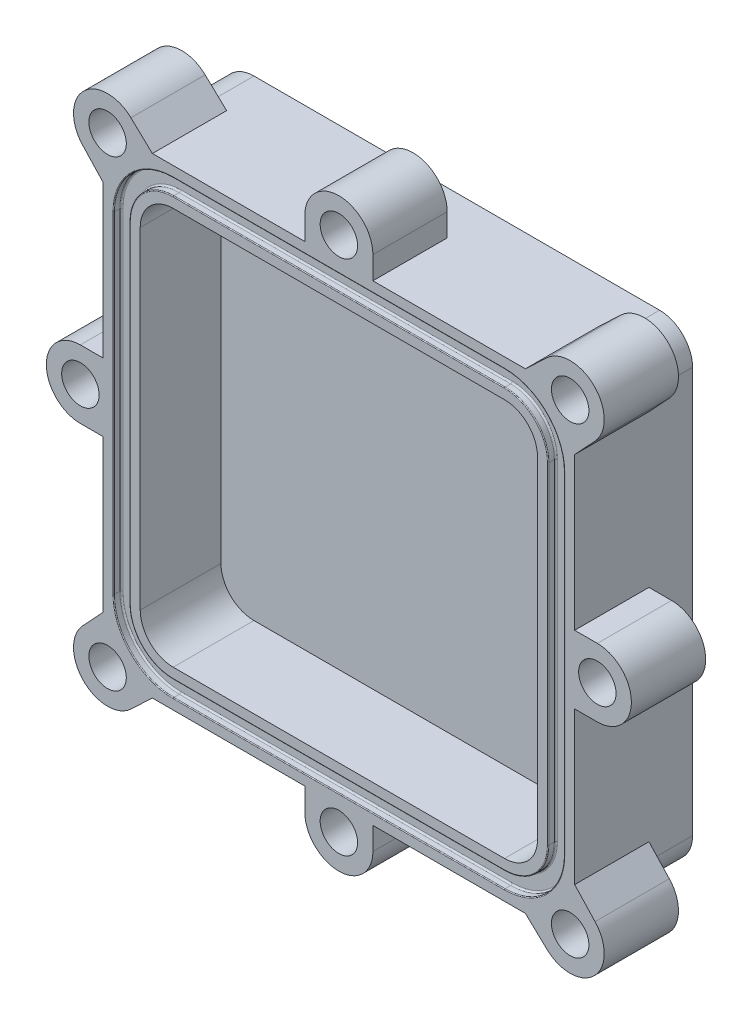
from build123d import *

# Parameters (mm, degrees)
SKETCH1_W               = 76.2
SKETCH1_H               = 76.2
BOSS_EXTRUDE1_DEPTH     = 19.05
SHELL4_T                = -6
FILLET3_R               = 5.334
FILLET4_R               = 5.334
CUT_EXTRUDE1_DEPTH      = 1.2446
FILLET5_R               = 0.254
FILLET6_R               = 0.127
BOSS_EXTRUDE2_DEPTH     = 12
SKETCH6_R               = 3.025
CUT_EXTRUDE2_DEPTH      = 9
MIRROR2_COPY_1_DEPTH    = 12
MIRROR2_COPY_2_SKETCH_R = 3.025
MIRROR2_COPY_2_DEPTH    = 9
SKETCH7_R               = 3.025
BOSS_EXTRUDE3_DEPTH     = 12
SKETCH8_R               = 3.025
CUT_EXTRUDE4_DEPTH      = 9
CIRPATTERN1_COUNT       = 4


with BuildPart() as part:
    # Sketch1 → Boss-Extrude1 (new body)
    with BuildSketch(Plane.XY):
        Rectangle(SKETCH1_W, SKETCH1_H)
    extrude(amount=BOSS_EXTRUDE1_DEPTH)

    # Shell4
    shell4_openings = [part.faces().sort_by_distance(p)[0] for p in [
        (0, 0, 19.05),
    ]]
    offset(amount=SHELL4_T, openings=shell4_openings, kind=Kind.INTERSECTION)

    # Fillet3
    fillet3_edges = [part.edges().sort_by_distance(p)[0] for p in [
        (32.1, -32.1, 12.525),
        (32.1, 32.1, 12.525),
        (-32.1, 32.1, 12.525),
        (-32.1, -32.1, 12.525),
    ]]
    fillet(fillet3_edges, radius=FILLET3_R)

    # Fillet4
    fillet4_edges = [part.edges().sort_by_distance(p)[0] for p in [
        (38.1, -38.1, 9.525),
        (-38.1, -38.1, 9.525),
        (-38.1, 38.1, 9.525),
        (38.1, 38.1, 9.525),
    ]]
    fillet(fillet4_edges, radius=FILLET4_R)

    # Sketch3 → Cut-Extrude1 (cut)
    with BuildSketch(Plane.XY.offset(19.05)):
        with BuildLine():
            Line((36.3827, -26.766), (36.3827, 26.766))
            ThreePointArc((36.3827, 26.766), (33.566033783, 33.566033783), (26.766, 36.3827))
            Line((26.766, 36.3827), (-26.766, 36.3827))
            ThreePointArc((-26.766, 36.3827), (-33.566033783, 33.566033783), (-36.3827, 26.766))
            Line((-36.3827, 26.766), (-36.3827, -26.766))
            ThreePointArc((-36.3827, -26.766), (-33.566033783, -33.566033783), (-26.766, -36.3827))
            Line((-26.766, -36.3827), (26.766, -36.3827))
            ThreePointArc((26.766, -36.3827), (33.566033783, -33.566033783), (36.3827, -26.766))
        make_face()
        with BuildLine():
            Line((-33.8173, 26.766), (-33.8173, -26.766))
            ThreePointArc((-33.8173, -26.766), (-31.752022046, -31.752022046), (-26.766, -33.8173))
            Line((-26.766, -33.8173), (26.766, -33.8173))
            ThreePointArc((26.766, -33.8173), (31.752022046, -31.752022046), (33.8173, -26.766))
            Line((33.8173, -26.766), (33.8173, 26.766))
            ThreePointArc((33.8173, 26.766), (31.752022046, 31.752022046), (26.766, 33.8173))
            Line((26.766, 33.8173), (-26.766, 33.8173))
            ThreePointArc((-26.766, 33.8173), (-31.752022046, 31.752022046), (-33.8173, 26.766))
        make_face(mode=Mode.SUBTRACT)
    extrude(amount=-CUT_EXTRUDE1_DEPTH, mode=Mode.SUBTRACT)

    # Fillet5
    fillet5_edges = [part.edges().sort_by_distance(p)[0] for p in [
        (33.566033783, -33.566033783, 17.8054),
        (0, -36.3827, 17.8054),
        (-33.566033783, -33.566033783, 17.8054),
        (-36.3827, 0, 17.8054),
        (-33.566033783, 33.566033783, 17.8054),
        (0, 36.3827, 17.8054),
        (33.566033783, 33.566033783, 17.8054),
        (36.3827, 0, 17.8054),
        (0, 33.8173, 17.8054),
        (-31.752022046, 31.752022046, 17.8054),
        (-33.8173, 0, 17.8054),
        (-31.752022046, -31.752022046, 17.8054),
        (0, -33.8173, 17.8054),
        (31.752022046, -31.752022046, 17.8054),
        (33.8173, 0, 17.8054),
        (31.752022046, 31.752022046, 17.8054),
    ]]
    fillet(fillet5_edges, radius=FILLET5_R)

    # Fillet6
    fillet6_edges = [part.edges().sort_by_distance(p)[0] for p in [
        (33.566033783, -33.566033783, 19.05),
        (36.3827, 0, 19.05),
        (33.566033783, 33.566033783, 19.05),
        (0, 36.3827, 19.05),
        (-33.566033783, 33.566033783, 19.05),
        (-36.3827, 0, 19.05),
        (-33.566033783, -33.566033783, 19.05),
        (0, -36.3827, 19.05),
        (-31.752022046, 31.752022046, 19.05),
        (0, 33.8173, 19.05),
        (31.752022046, 31.752022046, 19.05),
        (33.8173, 0, 19.05),
        (31.752022046, -31.752022046, 19.05),
        (0, -33.8173, 19.05),
        (-31.752022046, -31.752022046, 19.05),
        (-33.8173, 0, 19.05),
    ]]
    fillet(fillet6_edges, radius=FILLET6_R)

    # Sketch5 → Boss-Extrude2 (add)
    with BuildSketch(Plane.XY.offset(19.05)):
        with BuildLine():
            Line((31.920914663, -38.1), (30.131751686, -38.1))
            Line((30.131751686, -38.1), (33.596647392, -41.371622715))
            ThreePointArc((33.596647392, -41.371622715), (32.477377499, -39.879946896), (31.920914663, -38.1))
        make_face()
        with BuildLine():
            ThreePointArc((38.1, -31.920914663), (39.894470489, -32.484843755), (41.393974839, -33.620461233))
            Line((41.393974839, -33.620461233), (38.1, -30.090129163))
            Line((38.1, -30.090129163), (38.1, -31.920914663))
        make_face()
        with BuildLine():
            ThreePointArc((31.920914663, -38.1), (32.477377499, -39.879946896), (33.596647392, -41.371622715))
            ThreePointArc((33.596647392, -41.371622715), (39.550014312, -42.423232807), (42.872601718, -37.372601718))
            ThreePointArc((42.872601718, -37.372601718), (42.489610227, -35.356113703), (41.393974839, -33.620461233))
            ThreePointArc((41.393974839, -33.620461233), (39.894470489, -32.484843755), (38.1, -31.920914663))
            Line((38.1, -31.920914663), (38.1, -32.766))
            ThreePointArc((38.1, -32.766), (38.036695789, -33.585342355), (37.848285754, -34.385236709))
            ThreePointArc((37.848285754, -34.385236709), (39.673641614, -35.408972324), (40.397601718, -37.372601718))
            ThreePointArc((40.397601718, -37.372601718), (37.611186972, -40.388178292), (34.385236709, -37.848285754))
            ThreePointArc((34.385236709, -37.848285754), (33.585342355, -38.036695789), (32.766, -38.1))
            Line((32.766, -38.1), (31.920914663, -38.1))
        make_face()
        with BuildLine():
            ThreePointArc((32.673422332, -34.514680603), (31.989883894, -36.242845623), (31.920914663, -38.1))
            Line((31.920914663, -38.1), (32.766, -38.1))
            ThreePointArc((32.766, -38.1), (33.585342355, -38.036695789), (34.385236709, -37.848285754))
            ThreePointArc((34.385236709, -37.848285754), (35.233603705, -35.233603705), (37.848285754, -34.385236709))
            ThreePointArc((37.848285754, -34.385236709), (38.036695789, -33.585342355), (38.1, -32.766))
            Line((38.1, -32.766), (38.1, -31.920914663))
            ThreePointArc((38.1, -31.920914663), (36.242845623, -31.989883894), (34.514680603, -32.673422332))
            ThreePointArc((34.514680603, -32.673422332), (33.655836344, -33.655836344), (32.673422332, -34.514680603))
        make_face()
        with BuildLine():
            ThreePointArc((37.848285754, -34.385236709), (35.233603705, -35.233603705), (34.385236709, -37.848285754))
            ThreePointArc((34.385236709, -37.848285754), (36.537707571, -36.537707571), (37.848285754, -34.385236709))
        make_face()
        with BuildLine():
            ThreePointArc((37.848285754, -34.385236709), (36.537707571, -36.537707571), (34.385236709, -37.848285754))
            ThreePointArc((34.385236709, -37.848285754), (37.611186972, -40.388178292), (40.397601718, -37.372601718))
            ThreePointArc((40.397601718, -37.372601718), (39.673641614, -35.408972324), (37.848285754, -34.385236709))
        make_face()
    boss_extrude2 = extrude(amount=-BOSS_EXTRUDE2_DEPTH)

    # Sketch6 → Cut-Extrude2 (cut)
    with BuildSketch(Plane.XY.offset(19.05)):
        with Locations((37.372601718, -37.372601718)):
            Circle(SKETCH6_R)
    cut_extrude2 = extrude(amount=-CUT_EXTRUDE2_DEPTH, mode=Mode.SUBTRACT)

    # Mirror1: Boss-Extrude2, Cut-Extrude2 across plane
    add(boss_extrude2.mirror(Plane.ZX))
    add(cut_extrude2.mirror(Plane.ZX), mode=Mode.SUBTRACT)

    # Mirror2: Boss-Extrude2, Cut-Extrude2 across plane
    add(boss_extrude2.mirror(Plane(origin=(0, 0, 0), x_dir=(0, 0, 1), z_dir=(1, 0, 0))))
    add(cut_extrude2.mirror(Plane(origin=(0, 0, 0), x_dir=(0, 0, 1), z_dir=(1, 0, 0))), mode=Mode.SUBTRACT)

    # Mirror2 copy 1 sketch → Mirror2 copy 1 (add)
    with BuildSketch(Plane(origin=(0, 0, 19.05), x_dir=(-1, 0, 0), z_dir=(0, 0, 1))):
        with BuildLine():
            Line((31.920914663, -38.1), (30.131751686, -38.1))
            Line((30.131751686, -38.1), (33.596647392, -41.371622715))
            ThreePointArc((33.596647392, -41.371622715), (32.477377499, -39.879946896), (31.920914663, -38.1))
        make_face()
        with BuildLine():
            ThreePointArc((38.1, -31.920914663), (39.894470489, -32.484843755), (41.393974839, -33.620461233))
            Line((41.393974839, -33.620461233), (38.1, -30.090129163))
            Line((38.1, -30.090129163), (38.1, -31.920914663))
        make_face()
        with BuildLine():
            ThreePointArc((31.920914663, -38.1), (32.477377499, -39.879946896), (33.596647392, -41.371622715))
            ThreePointArc((33.596647392, -41.371622715), (39.550014312, -42.423232807), (42.872601718, -37.372601718))
            ThreePointArc((42.872601718, -37.372601718), (42.489610227, -35.356113703), (41.393974839, -33.620461233))
            ThreePointArc((41.393974839, -33.620461233), (39.894470489, -32.484843755), (38.1, -31.920914663))
            Line((38.1, -31.920914663), (38.1, -32.766))
            ThreePointArc((38.1, -32.766), (38.036695789, -33.585342355), (37.848285754, -34.385236709))
            ThreePointArc((37.848285754, -34.385236709), (39.673641614, -35.408972324), (40.397601718, -37.372601718))
            ThreePointArc((40.397601718, -37.372601718), (37.611186972, -40.388178292), (34.385236709, -37.848285754))
            ThreePointArc((34.385236709, -37.848285754), (33.585342355, -38.036695789), (32.766, -38.1))
            Line((32.766, -38.1), (31.920914663, -38.1))
        make_face()
        with BuildLine():
            ThreePointArc((32.673422332, -34.514680603), (31.989883894, -36.242845623), (31.920914663, -38.1))
            Line((31.920914663, -38.1), (32.766, -38.1))
            ThreePointArc((32.766, -38.1), (33.585342355, -38.036695789), (34.385236709, -37.848285754))
            ThreePointArc((34.385236709, -37.848285754), (35.233603705, -35.233603705), (37.848285754, -34.385236709))
            ThreePointArc((37.848285754, -34.385236709), (38.036695789, -33.585342355), (38.1, -32.766))
            Line((38.1, -32.766), (38.1, -31.920914663))
            ThreePointArc((38.1, -31.920914663), (36.242845623, -31.989883894), (34.514680603, -32.673422332))
            ThreePointArc((34.514680603, -32.673422332), (33.655836344, -33.655836344), (32.673422332, -34.514680603))
        make_face()
        with BuildLine():
            ThreePointArc((37.848285754, -34.385236709), (35.233603705, -35.233603705), (34.385236709, -37.848285754))
            ThreePointArc((34.385236709, -37.848285754), (36.537707571, -36.537707571), (37.848285754, -34.385236709))
        make_face()
        with BuildLine():
            ThreePointArc((37.848285754, -34.385236709), (36.537707571, -36.537707571), (34.385236709, -37.848285754))
            ThreePointArc((34.385236709, -37.848285754), (37.611186972, -40.388178292), (40.397601718, -37.372601718))
            ThreePointArc((40.397601718, -37.372601718), (39.673641614, -35.408972324), (37.848285754, -34.385236709))
        make_face()
    extrude(amount=-MIRROR2_COPY_1_DEPTH)

    # Mirror2 copy 2 sketch → Mirror2 copy 2 (cut)
    with BuildSketch(Plane(origin=(0, 0, 19.05), x_dir=(-1, 0, 0), z_dir=(0, 0, 1))):
        with Locations((37.372601718, -37.372601718)):
            Circle(MIRROR2_COPY_2_SKETCH_R)
    extrude(amount=-MIRROR2_COPY_2_DEPTH, mode=Mode.SUBTRACT)

    # Sketch7 → Boss-Extrude3 (add)
    # profile 1 of 4: a face of its own
    with BuildSketch(Plane.XY.offset(19.05)):
        with BuildLine():
            ThreePointArc((-4.10121615, -38.1), (-5.138418474, -39.803410733), (-5.5, -41.7647))
            ThreePointArc((-5.5, -41.7647), (0, -47.2647), (5.5, -41.7647))
            ThreePointArc((5.5, -41.7647), (5.138418474, -39.803410733), (4.10121615, -38.1))
            Line((4.10121615, -38.1), (-4.10121615, -38.1))
        make_face()
        with Locations((0, -41.7647)):
            Circle(SKETCH7_R, mode=Mode.SUBTRACT)
    # profile 2 of 4: a face of its own
    with BuildSketch(Plane.XY.offset(19.05)):
        with Locations((0, -41.7647)):
            Circle(SKETCH7_R)
    # profile 3 of 4: a face of its own
    with BuildSketch(Plane.XY.offset(19.05)):
        with BuildLine():
            Line((-5.5, -38.1), (-5.5, -41.7647))
            ThreePointArc((-5.5, -41.7647), (-5.138418474, -39.803410733), (-4.10121615, -38.1))
            Line((-4.10121615, -38.1), (-5.5, -38.1))
        make_face()
    # profile 4 of 4: a face of its own
    with BuildSketch(Plane.XY.offset(19.05)):
        with BuildLine():
            ThreePointArc((4.10121615, -38.1), (5.138418474, -39.803410733), (5.5, -41.7647))
            Line((5.5, -41.7647), (5.5, -38.1))
            Line((5.5, -38.1), (4.10121615, -38.1))
        make_face()
    boss_extrude3 = extrude(amount=-BOSS_EXTRUDE3_DEPTH)

    # Sketch8 → Cut-Extrude4 (cut)
    with BuildSketch(Plane.XY.offset(19.05)):
        with Locations((0, -41.7647)):
            Circle(SKETCH8_R)
    cut_extrude4 = extrude(amount=-CUT_EXTRUDE4_DEPTH, mode=Mode.SUBTRACT)

    # CirPattern1: Boss-Extrude3, Cut-Extrude4 ×4 about axis
    cirpattern1_axis = Axis((0, 0, 0), (0, 0, 1))
    add([boss_extrude3.rotate(cirpattern1_axis, i * 360 / CIRPATTERN1_COUNT) for i in range(1, CIRPATTERN1_COUNT)])
    add([cut_extrude4.rotate(cirpattern1_axis, i * 360 / CIRPATTERN1_COUNT) for i in range(1, CIRPATTERN1_COUNT)], mode=Mode.SUBTRACT)


solid = part.part
